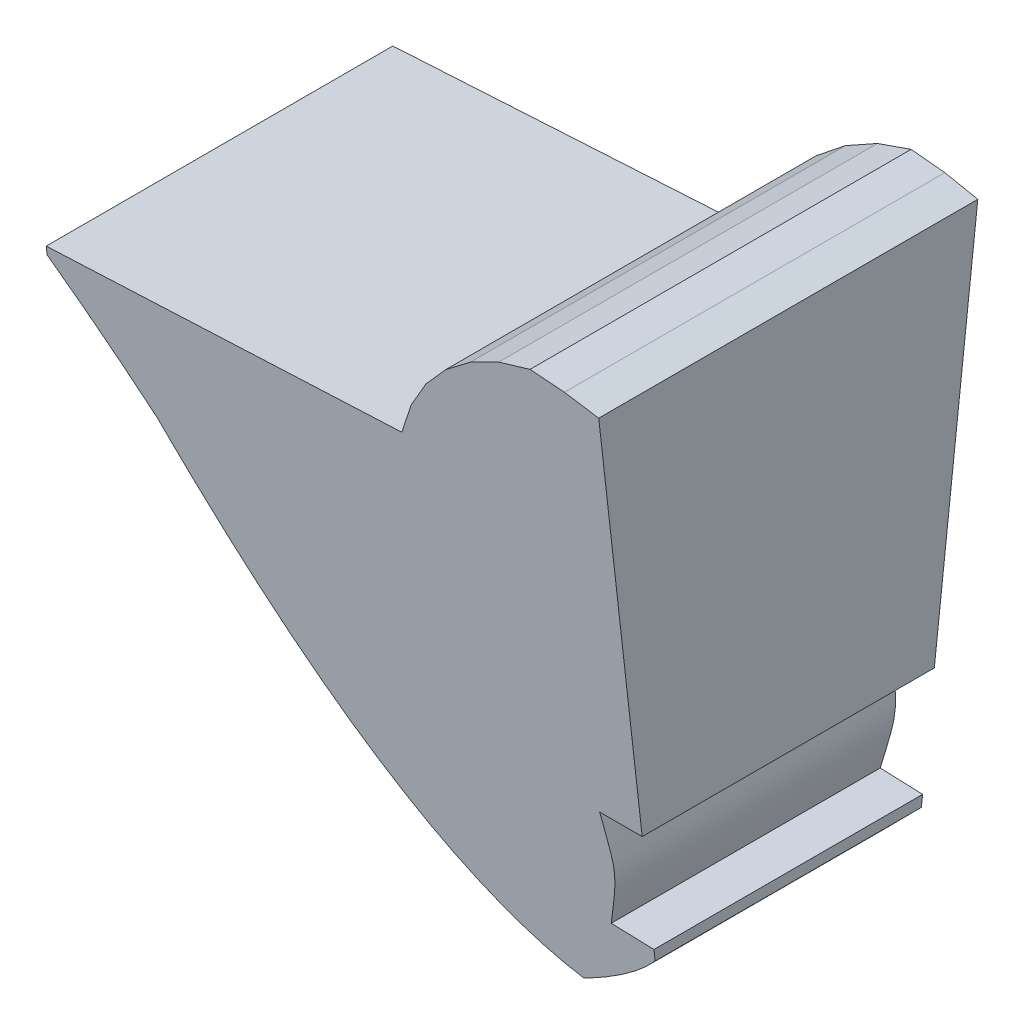
from build123d import *

# Parameters (mm, degrees)
SALIENTE_EXTRUIR1_DEPTH             = 7.21
SALIENTE_EXTRUIR2_DEPTH             = 7.21
SALIENTE_EXTRUIR2_DEPTH_BACK        = 7.21
CORTAR_EXTRUIR2_DEPTH               = 28.232395202
CORTAR_EXTRUIR2_DEPTH_BACK          = 28.232395202
SALIENTE_EXTRUIR3_REACH             = 29.232
SALIENTE_EXTRUIR3_DIRECTION_2_REACH = 29.232


with BuildPart() as part:
    # Croquis1 → Saliente-Extruir1 (new, symmetric)
    with BuildSketch(Plane.XY):
        with BuildLine():
            add(Edge.make_bspline(
                [(-18.945192114, 7.540918896), (-10.215008384, -3.697644103), (-2.846604825, -5.059081104)],
                knots=[0.497667241, 0.497667241, 0.497667241, 0.49955428, 0.49955428, 0.49955428], degree=2, weights=[1, 1, 1]))
            add(Edge.make_bspline(
                [(-2.846604825, -5.059081104), (-0.742366882, -3.9352066), (0.355125, -2.723253227)],
                knots=[0.498812075, 0.498812075, 0.498812075, 0.499412845, 0.499412845, 0.499412845], degree=2, weights=[1, 1, 1]))
            Line((0.355125, -2.723253227), (0.355125, -2.284841781))
            Line((0.355125, -2.284841781), (-1.394875, -2.223730435))
            add(Edge.make_bspline(
                [(-1.394875, -2.223730435), (-0.90753067, -0.123730435), (-1.394875, 1.976269565)],
                knots=[0, 0, 0, 1, 1, 1], degree=2, weights=[1, 3.231801219, 1]))
            Line((-1.394875, 1.976269565), (0.355125, 2.284841781))
            Line((0.355125, 2.284841781), (0.355125, 3.001549529))
            add(Edge.make_bspline(
                [(0.355125, 3.001549529), (-1.44872627, 6.058427314), (-6.994875026, 10.477389992)],
                knots=[0.500820705, 0.500820705, 0.500820705, 0.502013312, 0.502013312, 0.502013312], degree=2, weights=[1, 1, 1]))
            Line((-6.994875026, 10.477389992), (-8.981845695, 12.608155172))
            Line((-8.981845695, 12.608155172), (-23.035921146, 11.871612288))
            Line((-23.035921146, 11.871612288), (-23.035921146, 11.54013782))
            ThreePointArc((-23.035921146, 11.54013782), (-20.949684518, 9.582335705), (-18.945192114, 7.540918896))
        make_face()
    extrude(amount=SALIENTE_EXTRUIR1_DEPTH, both=True)

    # Croquis4 → Saliente-Extruir2 (add, two sides: drawn at the far end of the back side and taken through both)
    with BuildSketch(Plane.XY.offset(-SALIENTE_EXTRUIR2_DEPTH_BACK)):
        Polygon((-1.394875, 1.976269565), (0.355125, 2.284841781), (0.355125, 1.976269565), align=None)
    extrude(amount=SALIENTE_EXTRUIR2_DEPTH + SALIENTE_EXTRUIR2_DEPTH_BACK)

    # Croquis6 → Cortar-Extruir2 (cut, two sides: drawn at the far end of the back side and taken through both)
    with BuildSketch(Plane(origin=(0, 0, 0), x_dir=(0, 0, -1), z_dir=(1, 0, 0)).offset(-CORTAR_EXTRUIR2_DEPTH_BACK)):
        Polygon((7.21, 12.608155172), (7.21, -5.059081104), (5.21, -5.059081104), align=None)
        Polygon((-7.21, 12.608155172), (-7.21, -5.059081104), (-5.21, -5.059081104), align=None)
    extrude(amount=CORTAR_EXTRUIR2_DEPTH + CORTAR_EXTRUIR2_DEPTH_BACK, mode=Mode.SUBTRACT)

    # Saliente-Extruir3: up to this plane
    saliente_extruir3_end = Plane(origin=(-23.035921146, 12.608155172, 7.21), z_dir=(0, 0.1124854344122626, -0.9936533736897816))
    # Croquis8 → Saliente-Extruir3 (add, up to the surface)
    with BuildSketch(Plane.XY, mode=Mode.PRIVATE) as saliente_extruir3_sk1:
        with BuildLine():
            Line((0.355125, 3.001549529), (0.355125, 17.773466106))
            Line((0.355125, 17.773466106), (-1.028564504, 18.017447899))
            Line((-1.028564504, 18.017447899), (-2.428253067, 18.139904781))
            Line((-2.428253067, 18.139904781), (-3.764520897, 17.705725043))
            Line((-3.764520897, 17.705725043), (-5.005093297, 17.046100998))
            Line((-5.005093297, 17.046100998), (-6.1122761, 16.181074987))
            Line((-6.1122761, 16.181074987), (-7.052428119, 15.136930389))
            Line((-7.052428119, 15.136930389), (-7.796983309, 13.945393009))
            Line((-7.796983309, 13.945393009), (-8.323318739, 12.642667108))
            Line((-8.323318739, 12.642667108), (-9.726428332, 12.56913325))
            add(Edge.make_bspline(
                [(-9.726428332, 12.56913325), (-1.861127424, 6.757298639), (0.355125, 3.001549529)],
                knots=[0.500548048, 0.500548048, 0.500548048, 0.502013312, 0.502013312, 0.502013312], degree=2, weights=[1, 1, 1]))
        make_face()
    saliente_extruir3_tool1 = split(extrude(saliente_extruir3_sk1.sketch, amount=SALIENTE_EXTRUIR3_REACH, mode=Mode.PRIVATE), bisect_by=saliente_extruir3_end, keep=Keep.BOTH, mode=Mode.PRIVATE)
    add(saliente_extruir3_tool1.solids().sort_by_distance((-3.047394, 12.114755, 0))[0])

    # Saliente-Extruir3 direction 2: up to this plane
    saliente_extruir3_direction_2_end = Plane(origin=(-23.035921146, 12.608155172, -7.21), z_dir=(0, 0.1124854344122626, 0.9936533736897816))
    # Croquis8 → Saliente-Extruir3 direction 2 (add, up to the surface)
    with BuildSketch(Plane.XY, mode=Mode.PRIVATE) as saliente_extruir3_direction_2_sk1:
        with BuildLine():
            Line((0.355125, 3.001549529), (0.355125, 17.773466106))
            Line((0.355125, 17.773466106), (-1.028564504, 18.017447899))
            Line((-1.028564504, 18.017447899), (-2.428253067, 18.139904781))
            Line((-2.428253067, 18.139904781), (-3.764520897, 17.705725043))
            Line((-3.764520897, 17.705725043), (-5.005093297, 17.046100998))
            Line((-5.005093297, 17.046100998), (-6.1122761, 16.181074987))
            Line((-6.1122761, 16.181074987), (-7.052428119, 15.136930389))
            Line((-7.052428119, 15.136930389), (-7.796983309, 13.945393009))
            Line((-7.796983309, 13.945393009), (-8.323318739, 12.642667108))
            Line((-8.323318739, 12.642667108), (-9.726428332, 12.56913325))
            add(Edge.make_bspline(
                [(-9.726428332, 12.56913325), (-1.861127424, 6.757298639), (0.355125, 3.001549529)],
                knots=[0.500548048, 0.500548048, 0.500548048, 0.502013312, 0.502013312, 0.502013312], degree=2, weights=[1, 1, 1]))
        make_face()
    saliente_extruir3_direction_2_tool1 = split(extrude(saliente_extruir3_direction_2_sk1.sketch, amount=-SALIENTE_EXTRUIR3_DIRECTION_2_REACH, mode=Mode.PRIVATE), bisect_by=saliente_extruir3_direction_2_end, keep=Keep.BOTH, mode=Mode.PRIVATE)
    add(saliente_extruir3_direction_2_tool1.solids().sort_by_distance((-3.047394, 12.114755, 0))[0])


solid = part.part
